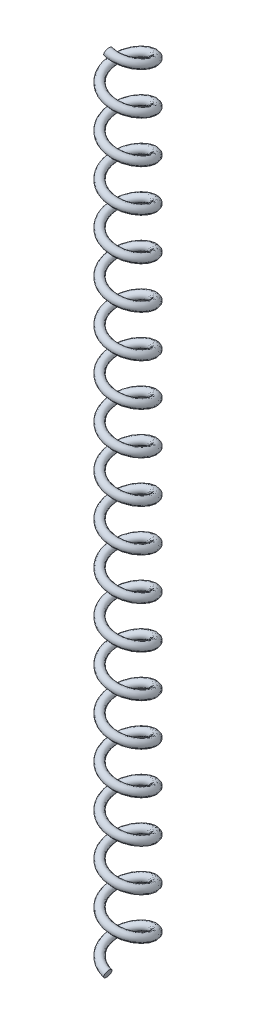
from build123d import *

# Parameters (mm, degrees)
COIL_WIRE_PITCH     = 2.605267677
COIL_WIRE_HEIGHT    = 49.500085861
COIL_WIRE_RADIUS    = 1.25
COIL_WIRE_PROFILE_R = 0.25


with BuildPart() as part:
    # Coil_Wire: sweep along a helix
    with BuildLine() as coil_wire_path:
        Helix(COIL_WIRE_PITCH, COIL_WIRE_HEIGHT, COIL_WIRE_RADIUS, center=(0, 0, 0), direction=(0, 1, 0), lefthand=True)
    # Coil_Wire profile (on start of the path) → Coil_Wire (sweep)
    with BuildSketch(Plane(origin=(0, 0, 1.25), x_dir=(-0.31484327876568846, -0.9491436718516703, 0), z_dir=(-0.9491436718516703, 0.31484327876568846, 1.4809134699799937e-13))):
        Circle(COIL_WIRE_PROFILE_R)
    sweep(path=coil_wire_path.line, is_frenet=True)


solid = part.part
